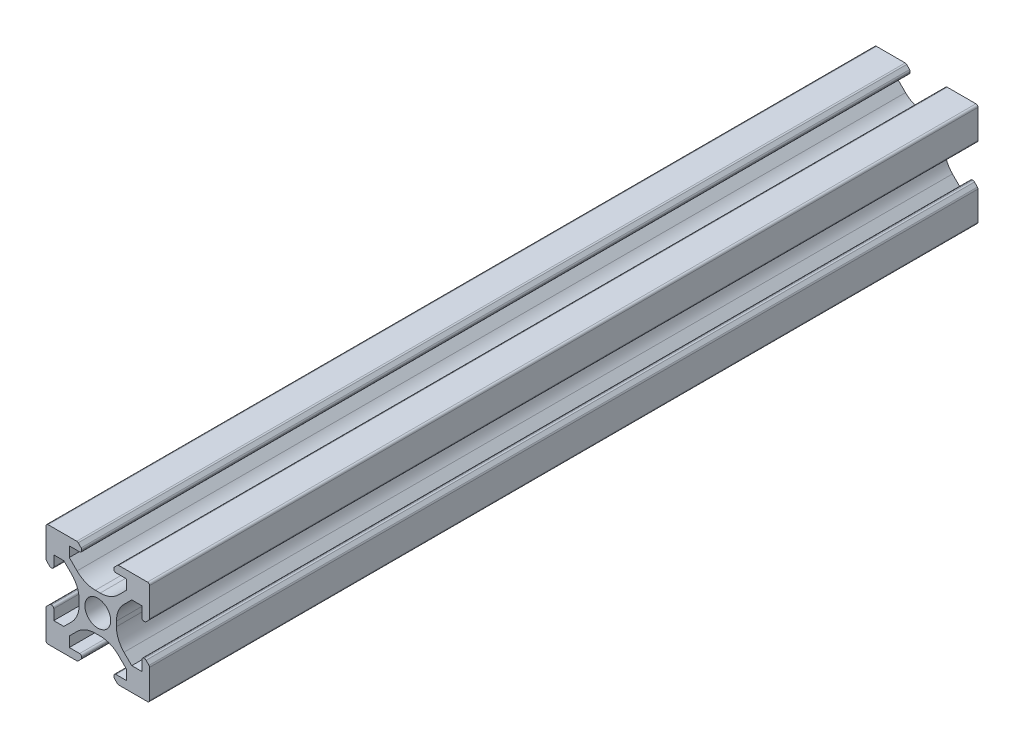
from build123d import *

# Parameters (mm, degrees)
RESSALTO_EXTRUS_O1_DEPTH = 160
PADR_OCIRCULAR1_COUNT    = 4
FILETE1_R                = 0.4


with BuildPart() as part:
    # Esboço1 → Ressalto-extrusão1 (new body)
    with BuildSketch(Plane.XY):
        with BuildLine():
            ThreePointArc((-9.317157288, 3.217157288), (-9.187387948, 3.130448187), (-9.034314575, 3.1))
            Line((-9.034314575, 3.1), (-8.9, 3.1))
            ThreePointArc((-8.9, 3.1), (-8.617157288, 3.217157288), (-8.5, 3.5))
            Line((-8.5, 3.5), (-8.5, 5.5))
            Line((-8.5, 5.5), (-6.560660172, 5.5))
            Line((-6.560660172, 5.5), (-5.064466094, 4.003805922))
            ThreePointArc((-5.064466094, 4.003805922), (-3.980602337, 2.381689178), (-3.6, 0.468272016))
            Line((-3.6, 0.468272016), (-3.6, 0))
            Line((-3.6, 0), (-2.5, 0))
            ThreePointArc((-2.5, 0), (-1.767766953, 1.767766953), (0, 2.5))
            Line((0, 2.5), (0, 3.6))
            Line((0, 3.6), (-0.468272016, 3.6))
            ThreePointArc((-0.468272016, 3.6), (-2.381689178, 3.980602337), (-4.003805922, 5.064466094))
            Line((-4.003805922, 5.064466094), (-5.5, 6.560660172))
            Line((-5.5, 6.560660172), (-5.5, 8.5))
            Line((-5.5, 8.5), (-3.5, 8.5))
            ThreePointArc((-3.5, 8.5), (-3.217157288, 8.617157288), (-3.1, 8.9))
            Line((-3.1, 8.9), (-3.1, 9.034314575))
            ThreePointArc((-3.1, 9.034314575), (-3.130448187, 9.187387948), (-3.217157288, 9.317157288))
            Line((-3.217157288, 9.317157288), (-3.782842712, 9.882842712))
            ThreePointArc((-3.782842712, 9.882842712), (-3.912612052, 9.969551813), (-4.065685425, 10))
            Line((-4.065685425, 10), (-10, 10))
            Line((-10, 10), (-10, 4.065685425))
            ThreePointArc((-10, 4.065685425), (-9.969551813, 3.912612052), (-9.882842712, 3.782842712))
            Line((-9.882842712, 3.782842712), (-9.317157288, 3.217157288))
        make_face()
    ressalto_extrus_o1 = extrude(amount=RESSALTO_EXTRUS_O1_DEPTH)

    # PadrãoCircular1: Ressalto-extrusão1 ×4 about axis
    padr_ocircular1_axis = Axis((0, 0, 0), (0, 0, 1))
    for i in range(1, PADR_OCIRCULAR1_COUNT):
        add(ressalto_extrus_o1.rotate(padr_ocircular1_axis, i * 360 / PADR_OCIRCULAR1_COUNT))

    # Filete1
    filete1_edges = [part.edges().sort_by_distance(p)[0] for p in [
        (10, -10, 80),
        (10, 10, 80),
        (-10, 10, 80),
        (-10, -10, 80),
    ]]
    fillet(filete1_edges, radius=FILETE1_R)


solid = part.part
